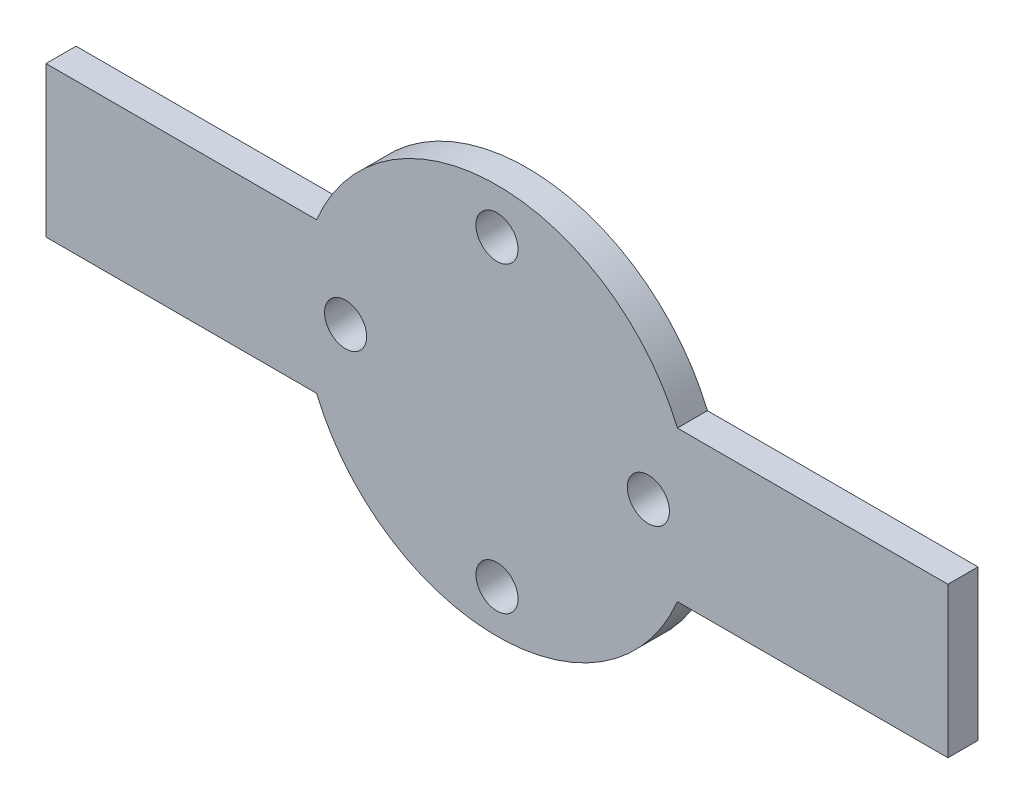
from build123d import *

# Parameters (mm, degrees)
SKIZZE1_R                       = 32.5
AUFSATZ_LINEAR_AUSTRAGEN1_DEPTH = 5
SKIZZE2_R                       = 3.5
SCHNITT_LINEAR_AUSTRAGEN1_DEPTH = 10
SKIZZE3_W                       = 150
SKIZZE3_H                       = 25
AUFSATZ_LINEAR_AUSTRAGEN2_DEPTH = 5
KREISMUSTER1_COUNT              = 4


with BuildPart() as part:
    # Skizze1 → Aufsatz-Linear austragen1 (new body)
    with BuildSketch(Plane.XY):
        Circle(SKIZZE1_R)
    extrude(amount=AUFSATZ_LINEAR_AUSTRAGEN1_DEPTH)

    # Skizze2 → Schnitt-Linear austragen1 (cut)
    with BuildSketch(Plane(origin=(0, 0, 0), x_dir=(-1, 0, 0), z_dir=(0, 0, -1))):
        with Locations((0, 25)):
            Circle(SKIZZE2_R)
    schnitt_linear_austragen1 = extrude(amount=-SCHNITT_LINEAR_AUSTRAGEN1_DEPTH, mode=Mode.SUBTRACT)

    # Skizze3 → Aufsatz-Linear austragen2 (add)
    with BuildSketch(Plane(origin=(0, 0, 0), x_dir=(-1, 0, 0), z_dir=(0, 0, -1))):
        Rectangle(SKIZZE3_W, SKIZZE3_H)
    extrude(amount=-AUFSATZ_LINEAR_AUSTRAGEN2_DEPTH)

    # Kreismuster1: Schnitt-Linear austragen1 ×4 about axis
    kreismuster1_axis = Axis((0, -0.17666974, 0), (0, 0, 1))
    for i in range(1, KREISMUSTER1_COUNT):
        add(schnitt_linear_austragen1.rotate(kreismuster1_axis, i * 360 / KREISMUSTER1_COUNT), mode=Mode.SUBTRACT)


solid = part.part
